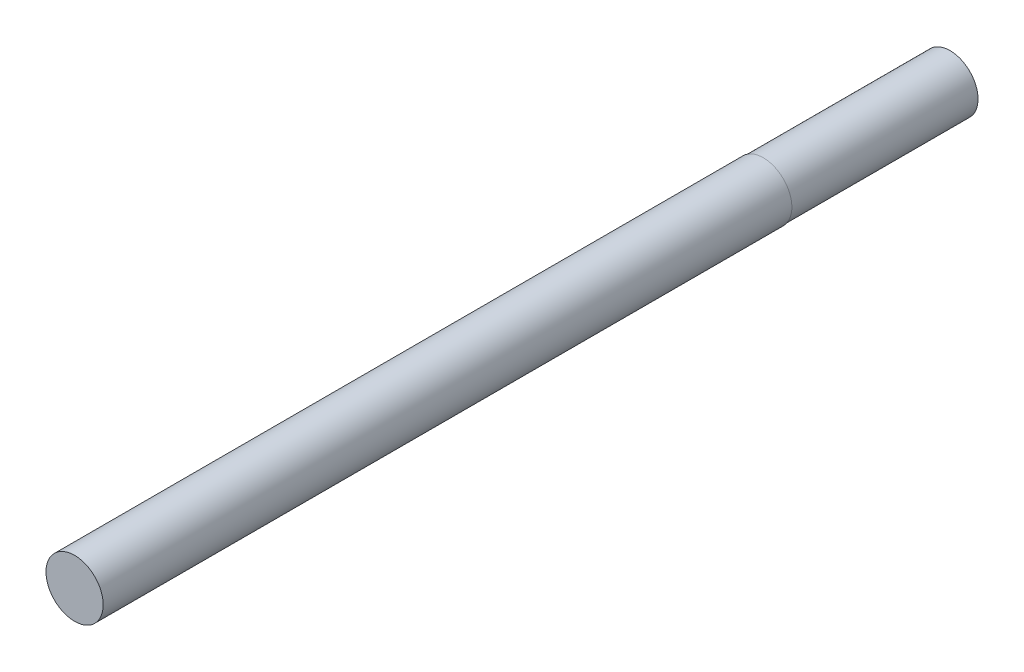
from build123d import *

# Parameters (mm, degrees)
SKETCH_2_R          = 2.45
EXTRUDE_1_DEPTH     = 75
SKETCH_4_R          = 2.45
SKETCH_4_R_2        = 2.4
CUT_EXTRUDE_2_DEPTH = 16


with BuildPart() as part:
    # 草图2 → 凸台-拉伸1 (new body)
    with BuildSketch(Plane.XY):
        Circle(SKETCH_2_R)
    extrude(amount=EXTRUDE_1_DEPTH)

    # 草图4 → 切除-拉伸2 (cut)
    with BuildSketch(Plane(origin=(0, 0, 0), x_dir=(-1, 0, 0), z_dir=(0, 0, -1))):
        Circle(SKETCH_4_R)
        Circle(SKETCH_4_R_2, mode=Mode.SUBTRACT)
    extrude(amount=-CUT_EXTRUDE_2_DEPTH, mode=Mode.SUBTRACT)


solid = part.part
